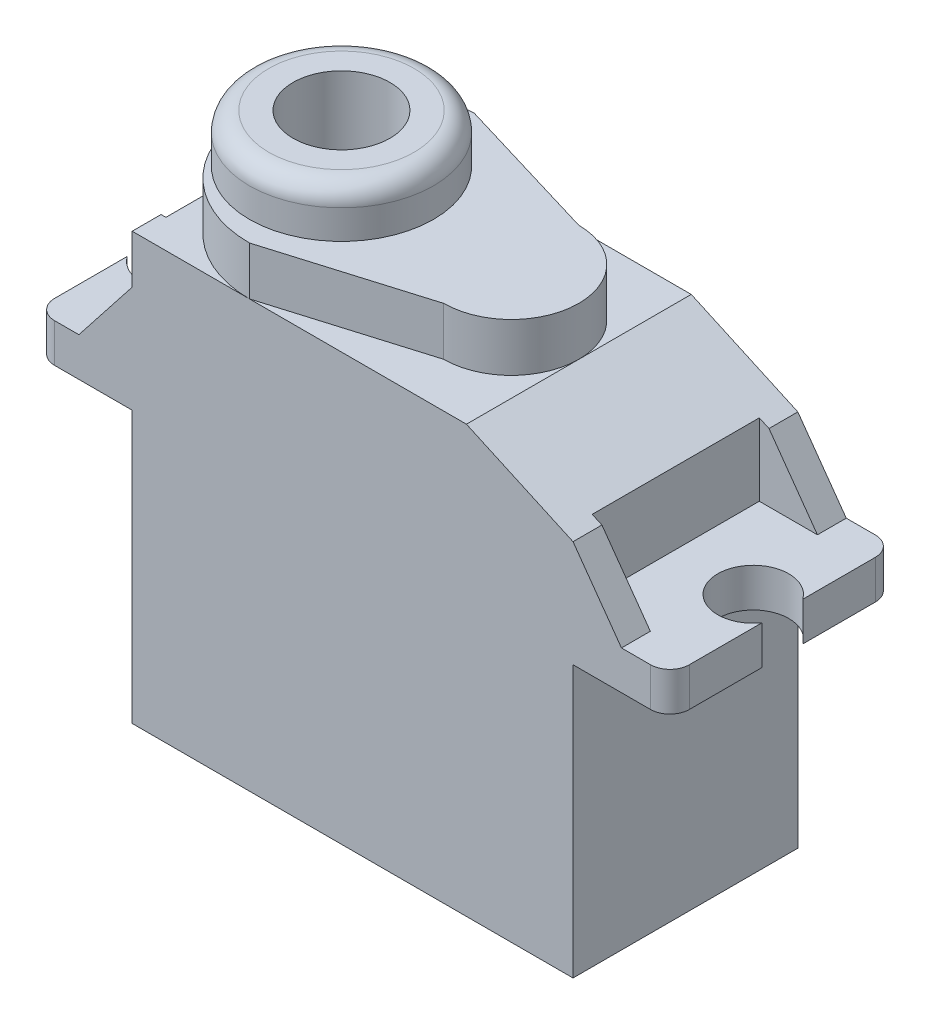
from build123d import *

# Parameters (mm, degrees)
BOSS_EXTRUDE1_DEPTH = 11.6
SKETCH2_R           = 1.833883236
CUT_EXTRUDE1_DEPTH  = 11.6
SKETCH3_W           = 28
SKETCH3_H           = 11.6
BOSS_EXTRUDE2_DEPTH = 6
SKETCH4_W           = 3
SKETCH4_H           = 8.622731964
CUT_EXTRUDE2_DEPTH  = 6
CUT_EXTRUDE3_DEPTH  = 12
BOSS_EXTRUDE3_DEPTH = 2.5
SKETCH7_R           = 4.75
BOSS_EXTRUDE4_DEPTH = 2.5
SKETCH8_R           = 2.5
CUT_EXTRUDE4_DEPTH  = 5
FILLET1_R           = 1


with BuildPart() as part:
    # Sketch1 → Boss-Extrude1 (new body)
    with BuildSketch(Plane.XY):
        Polygon((-9.992412141, 0), (12.757587859, 0), (12.757587859, 14), (17.757587859, 14), (17.757587859, 16), (-14.992412141, 16), (-14.992412141, 14), (-9.992412141, 14), align=None)
    extrude(amount=BOSS_EXTRUDE1_DEPTH)

    # Sketch2 → Cut-Extrude1 (cut)
    with BuildSketch(Plane(origin=(0, 16, 0), x_dir=(1, 0, 0), z_dir=(0, 1, 0))):
        with Locations((-13.492412141, -5.8)):
            Circle(SKETCH2_R)
        with Locations((16.257587859, -5.8)):
            Circle(SKETCH2_R)
    extrude(amount=-CUT_EXTRUDE1_DEPTH, mode=Mode.SUBTRACT)

    # Sketch3 → Boss-Extrude2 (add)
    with BuildSketch(Plane(origin=(0, 16, 0), x_dir=(1, 0, 0), z_dir=(0, 1, 0))):
        with Locations((1.257587859, -5.8)):
            Rectangle(SKETCH3_W, SKETCH3_H)
    extrude(amount=BOSS_EXTRUDE2_DEPTH)

    # Sketch4 → Cut-Extrude2 (cut)
    with BuildSketch(Plane(origin=(0, 22, 0), x_dir=(1, 0, 0), z_dir=(0, 1, 0))):
        with Locations((-11.242412141, -5.798634018)):
            Rectangle(SKETCH4_W, SKETCH4_H)
        with Locations((13.757587859, -5.798634018)):
            Rectangle(SKETCH4_W, SKETCH4_H)
    extrude(amount=-CUT_EXTRUDE2_DEPTH, mode=Mode.SUBTRACT)

    # Sketch5 → Cut-Extrude3 (cut)
    with BuildSketch(Plane.XY.offset(11.6)):
        Polygon((-9.992412141, 22), (-9.992412141, 19.5), (-12.742412141, 16), (-12.742412141, 22), align=None)
        Polygon((15.257587859, 16), (12.757587859, 19.5), (7.257587859, 22), (15.257587859, 22), align=None)
    extrude(amount=-CUT_EXTRUDE3_DEPTH, mode=Mode.SUBTRACT)

    # Sketch6 → Boss-Extrude3 (add)
    with BuildSketch(Plane(origin=(0, 22, 0), x_dir=(1, 0, 0), z_dir=(0, 1, 0))):
        with BuildLine():
            Line((-3.941512272, 0.001799738), (3.770704356, -2.312836319))
            ThreePointArc((3.770704356, -2.312836319), (7.257587859, -5.799719822), (3.770704356, -9.286603326))
            Line((3.770704356, -9.286603326), (-3.941512272, -11.6))
            ThreePointArc((-3.941512272, -11.6), (-9.742412141, -5.799100131), (-3.941512272, 0.001799738))
        make_face()
    extrude(amount=BOSS_EXTRUDE3_DEPTH)

    # Sketch7 → Boss-Extrude4 (add)
    with BuildSketch(Plane(origin=(0, 24.5, 0), x_dir=(1, 0, 0), z_dir=(0, 1, 0))):
        with Locations(Location((-4.992412141, -5.798937404, 0), (0, 0, 179.98128479))):
            Circle(SKETCH7_R)
    extrude(amount=BOSS_EXTRUDE4_DEPTH)

    # Sketch8 → Cut-Extrude4 (cut)
    with BuildSketch(Plane(origin=(0, 27, 0), x_dir=(1, 0, 0), z_dir=(0, 1, 0))):
        with Locations(Location((-4.992412141, -5.798937404, 0), (0, 0, 270))):
            Circle(SKETCH8_R)
    extrude(amount=-CUT_EXTRUDE4_DEPTH, mode=Mode.SUBTRACT)

    # Fillet1
    fillet1_edges = [part.edges().sort_by_distance(p)[0] for p in [
        (17.757587859, 15, 11.6),
        (-0.242412394, 27, 5.800488954),
        (-14.992412141, 15, 11.6),
        (-14.992412141, 15, 0),
        (17.757587859, 15, 0),
    ]]
    fillet(fillet1_edges, radius=FILLET1_R)


solid = part.part
